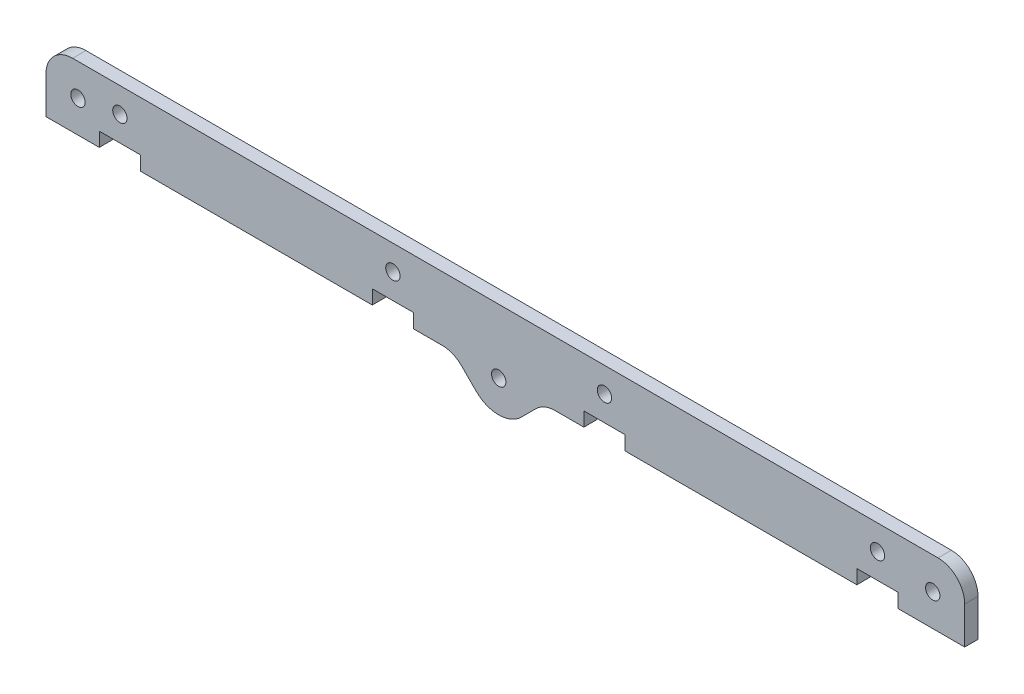
from build123d import *

# Parameters (mm, degrees)
SKETCH1_R           = 2.7
BOSS_EXTRUDE1_DEPTH = 5
FILLET1_R           = 10


with BuildPart() as part:
    # Sketch1 → Boss-Extrude1 (new body)
    with BuildSketch(Plane.XY):
        with BuildLine():
            Line((0, 0), (20, 0))
            Line((20, 0), (20, 5.3))
            Line((20, 5.3), (35.5, 5.3))
            Line((35.5, 5.3), (35.5, 0))
            Line((35.5, 0), (122.529437252, 0))
            Line((122.529437252, 0), (122.529437252, 5.3))
            Line((122.529437252, 5.3), (138.029437252, 5.3))
            Line((138.029437252, 5.3), (138.029437252, 0))
            Line((138.029437252, 0), (153.029437252, 0))
            Line((153.029437252, 0), (161.514718626, -8.485281374))
            ThreePointArc((161.514718626, -8.485281374), (170, -12), (178.485281374, -8.485281374))
            Line((178.485281374, -8.485281374), (186.970562748, 0))
            Line((186.970562748, 0), (201.970562748, 0))
            Line((201.970562748, 0), (201.970562748, 5.3))
            Line((201.970562748, 5.3), (217.470562748, 5.3))
            Line((217.470562748, 5.3), (217.470562748, 0))
            Line((217.470562748, 0), (304.5, 0))
            Line((304.5, 0), (304.5, 5.3))
            Line((304.5, 5.3), (320, 5.3))
            Line((320, 5.3), (320, 0))
            Line((320, 0), (345, 0))
            Line((345, 0), (345, 24))
            Line((345, 24), (0, 24))
            Line((0, 24), (0, 0))
        make_face()
        with Locations((170, 0)):
            Circle(SKETCH1_R, mode=Mode.SUBTRACT)
        with Locations((12, 12)):
            Circle(SKETCH1_R, mode=Mode.SUBTRACT)
        with Locations((333, 12)):
            Circle(SKETCH1_R, mode=Mode.SUBTRACT)
        with Locations((27.75, 14.65)):
            Circle(SKETCH1_R, mode=Mode.SUBTRACT)
        with Locations((130.279437252, 14.65)):
            Circle(SKETCH1_R, mode=Mode.SUBTRACT)
        with Locations((209.720562748, 14.65)):
            Circle(SKETCH1_R, mode=Mode.SUBTRACT)
        with Locations((312.25, 14.65)):
            Circle(SKETCH1_R, mode=Mode.SUBTRACT)
    extrude(amount=BOSS_EXTRUDE1_DEPTH)

    # Fillet1
    fillet1_edges = [part.edges().sort_by_distance(p)[0] for p in [
        (0, 24, 2.5),
        (345, 24, 2.5),
        (186.970562748, 0, 2.5),
        (153.029437252, 0, 2.5),
    ]]
    fillet(fillet1_edges, radius=FILLET1_R)


solid = part.part
